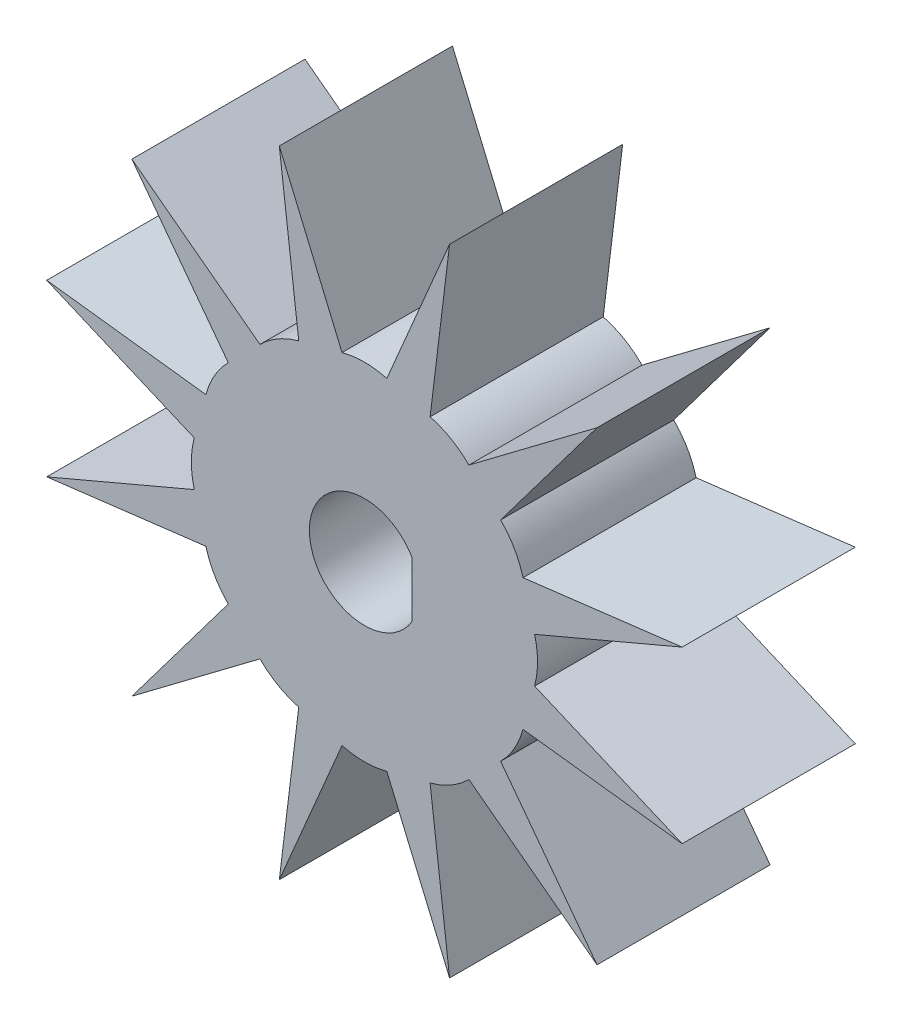
from build123d import *

# Parameters (mm, degrees)
SKETCH2_R          = 19
BASECIRCLE_DEPTH   = 5
CUT_EXTRUDE2_DEPTH = 8
CUT_EXTRUDE1_DEPTH = 10
CIRPATTERN1_COUNT  = 12


with BuildPart() as part:
    # Sketch2 → BaseCircle (new, symmetric)
    with BuildSketch(Plane.XY.offset(8)):
        with Locations((25, 25)):
            Circle(SKETCH2_R)
    extrude(amount=BASECIRCLE_DEPTH, both=True)

    # Sketch4 → Cut-Extrude2 (cut)
    with BuildSketch(Plane.XY.offset(13)):
        with BuildLine():
            Line((27.753960784, 26.59), (27.753960784, 23.41))
            ThreePointArc((27.753960784, 23.41), (21.82, 25), (27.753960784, 26.59))
        make_face()
    extrude(amount=-CUT_EXTRUDE2_DEPTH, mode=Mode.SUBTRACT)

    # Sketch3 → Cut-Extrude1 (cut)
    with BuildSketch(Plane.XY.offset(13)):
        with BuildLine():
            Line((20.082438143, 6.647409301), (23.705904774, 15.170370869))
            ThreePointArc((23.705904774, 15.170370869), (25, 15), (26.294095226, 15.170370869))
            Line((26.294095226, 15.170370869), (29.917561857, 6.647409301))
            ThreePointArc((29.917561857, 6.647409301), (25, 6), (20.082438143, 6.647409301))
        make_face()
    cut_extrude1 = extrude(amount=-CUT_EXTRUDE1_DEPTH, mode=Mode.SUBTRACT)

    # CirPattern1: Cut-Extrude1 ×12 about axis
    cirpattern1_axis = Axis((25, 25, 0), (0, 0, 1))
    for i in range(1, CIRPATTERN1_COUNT):
        add(cut_extrude1.rotate(cirpattern1_axis, i * 360 / CIRPATTERN1_COUNT), mode=Mode.SUBTRACT)


solid = part.part
